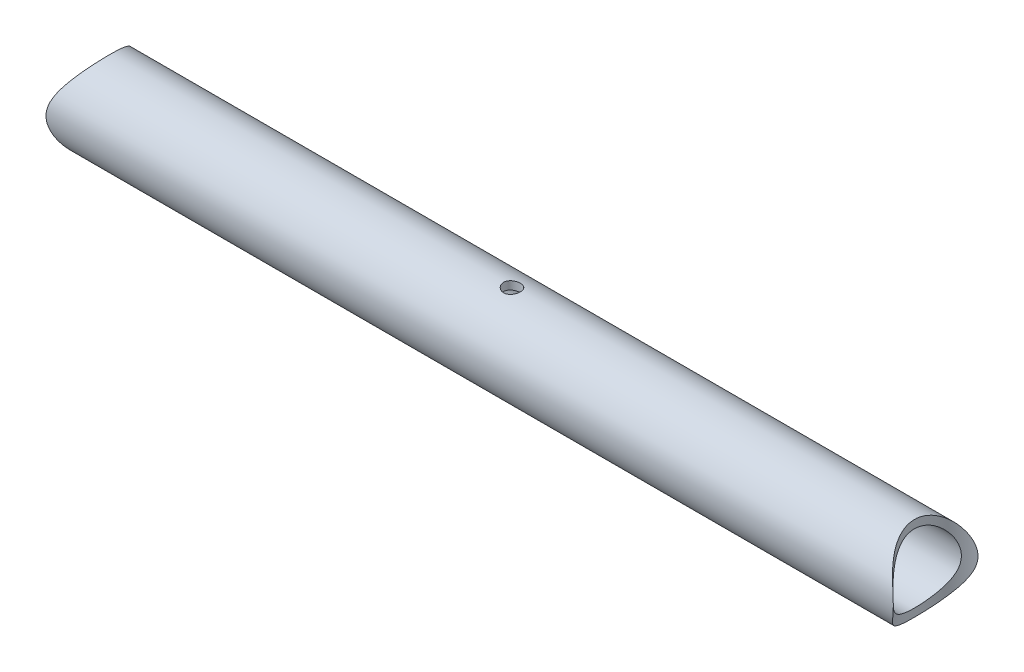
from build123d import *

# Parameters (mm, degrees)
BOSS_EXTRUDE1_DEPTH      = 135
BOSS_EXTRUDE1_DEPTH_BACK = 135
SKETCH1_R                = 12.7
SKETCH1_R_2              = 10.287
CUT_EXTRUDE1_DEPTH       = 25.4
CUT_EXTRUDE1_DEPTH_BACK  = 25.4
SKETCH2_R                = 15.875
SKETCH2_R_2              = 2.5


with BuildPart() as part:
    # Sketch1 → Boss-Extrude1 (new, two sides: drawn at the far end of the back side and taken through both)
    with BuildSketch(Plane(origin=(0, 0, 0), x_dir=(0, 0, -1), z_dir=(1, 0, 0)).offset(-BOSS_EXTRUDE1_DEPTH_BACK)):
        Circle(SKETCH1_R)
        Circle(SKETCH1_R_2, mode=Mode.SUBTRACT)
    extrude(amount=BOSS_EXTRUDE1_DEPTH + BOSS_EXTRUDE1_DEPTH_BACK)

    # Sketch2 → Cut-Extrude1 (cut, two sides: drawn at the far end of the back side and taken through both)
    with BuildSketch(Plane(origin=(0, 0, 0), x_dir=(1, 0, 0), z_dir=(0, 1, 0)).offset(-CUT_EXTRUDE1_DEPTH_BACK)):
        with Locations((-136.525, 0)):
            Circle(SKETCH2_R)
        with Locations((136.525, 0)):
            Circle(SKETCH2_R)
        Circle(SKETCH2_R_2)
    extrude(amount=CUT_EXTRUDE1_DEPTH + CUT_EXTRUDE1_DEPTH_BACK, mode=Mode.SUBTRACT)


solid = part.part
